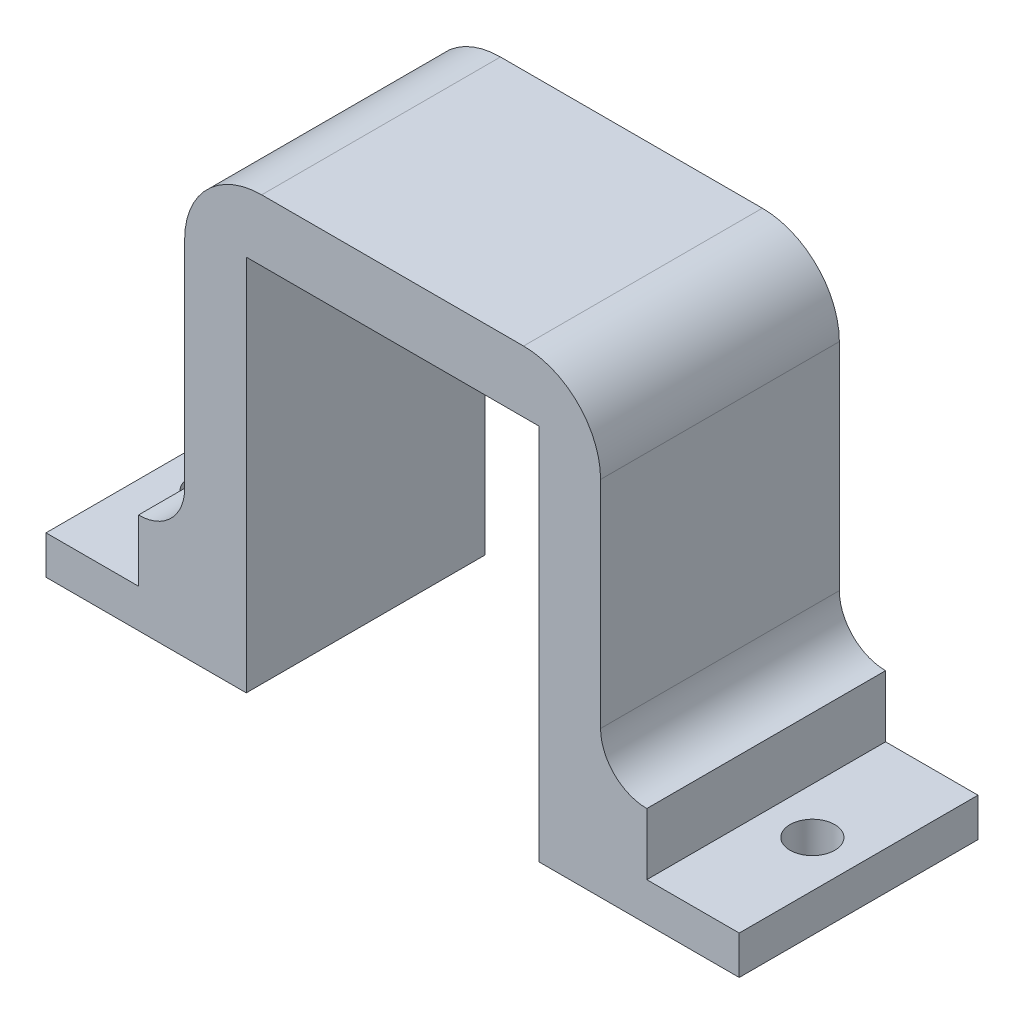
from build123d import *

# Parameters (mm, degrees)
BOSS_EXTRUDE1_DEPTH     = 23
CUT_EXTRUDE2_DEPTH      = 23
CUT_EXTRUDE2_DEPTH_BACK = 10
SKETCH4_W               = 3.5
SKETCH4_H               = 21
SKETCH5_W               = 45
SKETCH5_H               = 7.5
CUT_EXTRUDE3_DEPTH      = 26
SKETCH7_R               = 1.45
CUT_EXTRUDE4_DEPTH      = 50
SKETCH8_W               = 13
SKETCH8_H               = 15.5
BOSS_EXTRUDE2_DEPTH     = 2.5
SKETCH9_R               = 1.45
CUT_EXTRUDE5_DEPTH      = 10
SKETCH10_W              = 15.5
SKETCH10_H              = 4
CUT_EXTRUDE7_DEPTH      = 6
SKETCH11_W              = 15.5
SKETCH11_H              = 4
CUT_EXTRUDE8_DEPTH      = 6


with BuildPart() as part:
    # Sketch1 → Boss-Extrude1 (new body)
    with BuildSketch(Plane.XY):
        with BuildLine():
            Line((0, 3), (0, 17))
            ThreePointArc((0, 17), (1.464466094, 20.535533906), (5, 22))
            Line((5, 22), (22, 22))
            ThreePointArc((22, 22), (25.535533906, 20.535533906), (27, 17))
            Line((27, 17), (27, 3))
            ThreePointArc((27, 3), (27.878679656, 0.878679656), (30, 0))
            Line((30, 0), (36, 0))
            Line((36, 0), (36, -4))
            Line((36, -4), (23, -4))
            Line((23, -4), (23, 18))
            Line((23, 18), (4, 18))
            Line((4, 18), (4, -4))
            Line((4, -4), (-9, -4))
            Line((-9, -4), (-9, 0))
            Line((-9, 0), (-3, 0))
            ThreePointArc((-3, 0), (-0.878679656, 0.878679656), (0, 3))
        make_face()
    extrude(amount=BOSS_EXTRUDE1_DEPTH)

    # Sketch4 → Cut-Extrude2 (cut, two sides: drawn at the far end of the back side and taken through both)
    with BuildSketch(Plane.ZY.offset(-CUT_EXTRUDE2_DEPTH_BACK)):
        with Locations((5.75, 6.5)):
            Rectangle(SKETCH4_W, SKETCH4_H)
    extrude(amount=CUT_EXTRUDE2_DEPTH + CUT_EXTRUDE2_DEPTH_BACK, mode=Mode.SUBTRACT)

    # Sketch5 → Cut-Extrude3 (cut)
    with BuildSketch(Plane(origin=(0, 22, 0), x_dir=(1, 0, 0), z_dir=(0, 1, 0))):
        with Locations((13.5, -3.75)):
            Rectangle(SKETCH5_W, SKETCH5_H)
    extrude(amount=-CUT_EXTRUDE3_DEPTH, mode=Mode.SUBTRACT)

    # Sketch7 → Cut-Extrude4 (cut)
    with BuildSketch(Plane(origin=(0, 0, 0), x_dir=(1, 0, 0), z_dir=(0, 1, 0))):
        with Locations(Location((-6, -15.25, 0), (0, 0, 270))):
            Circle(SKETCH7_R)
        with Locations(Location((33, -15.25, 0), (0, 0, 180))):
            Circle(SKETCH7_R)
    extrude(amount=-CUT_EXTRUDE4_DEPTH, mode=Mode.SUBTRACT)

    # Sketch8 → Boss-Extrude2 (add)
    with BuildSketch(Plane.XZ.offset(4)):
        with Locations((29.5, 15.25)):
            Rectangle(SKETCH8_W, SKETCH8_H)
        with Locations((-2.5, 15.25)):
            Rectangle(SKETCH8_W, SKETCH8_H)
    extrude(amount=BOSS_EXTRUDE2_DEPTH)

    # Sketch9 → Cut-Extrude5 (cut)
    with BuildSketch(Plane(origin=(0, -4, 0), x_dir=(1, 0, 0), z_dir=(0, 1, 0))):
        with Locations((33, -15.25)):
            Circle(SKETCH9_R)
        with Locations(Location((-6, -15.25, 0), (0, 0, 270))):
            Circle(SKETCH9_R)
    extrude(amount=-CUT_EXTRUDE5_DEPTH, mode=Mode.SUBTRACT)

    # Sketch10 → Cut-Extrude7 (cut)
    with BuildSketch(Plane.ZY.offset(9)):
        with Locations((15.25, -2)):
            Rectangle(SKETCH10_W, SKETCH10_H)
    extrude(amount=-CUT_EXTRUDE7_DEPTH, mode=Mode.SUBTRACT)

    # Sketch11 → Cut-Extrude8 (cut)
    with BuildSketch(Plane(origin=(36, 0, 0), x_dir=(0, 0, -1), z_dir=(1, 0, 0))):
        with Locations((-15.25, -2)):
            Rectangle(SKETCH11_W, SKETCH11_H)
    extrude(amount=-CUT_EXTRUDE8_DEPTH, mode=Mode.SUBTRACT)


solid = part.part
